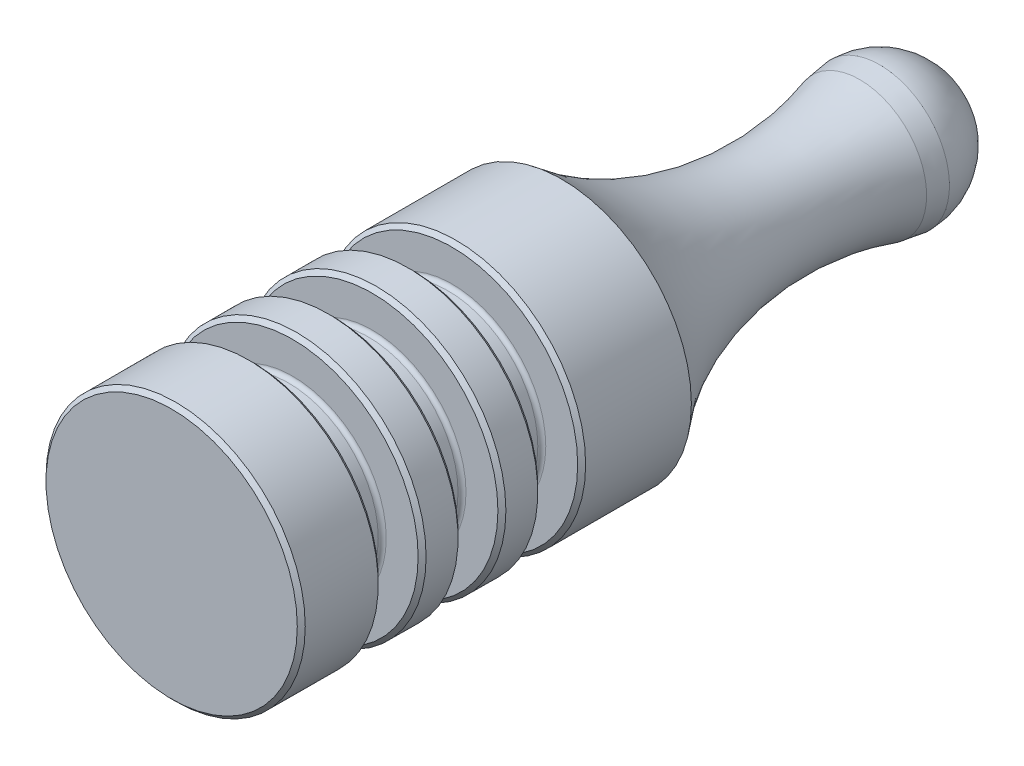
from build123d import *

# Parameters (mm, degrees)
SKIZZE1_R                       = 6.5
AUFSATZ_LINEAR_AUSTRAGEN1_DEPTH = 35.5
SKIZZE2_W                       = 2
SKIZZE2_H                       = 2
FASE1_SIZE                      = 0.2
VERRUNDUNG1_R                   = 0.2


with BuildPart() as part:
    # Skizze1 → Aufsatz-Linear austragen1 (new body)
    with BuildSketch(Plane.XY):
        Circle(SKIZZE1_R)
    extrude(amount=AUFSATZ_LINEAR_AUSTRAGEN1_DEPTH)

    # Skizze2 → Schnitt-Rotation1 (revolve, cut)
    with BuildSketch(Plane(origin=(0, 0, 0), x_dir=(0, 0, -1), z_dir=(1, 0, 0)), mode=Mode.PRIVATE) as schnitt_rotation1_sk:
        with Locations((-30.44, 5.5)):
            Rectangle(SKIZZE2_W, SKIZZE2_H)
        with Locations((-26.44, 5.5)):
            Rectangle(SKIZZE2_W, SKIZZE2_H)
        with Locations((-22.44, 5.5)):
            Rectangle(SKIZZE2_W, SKIZZE2_H)
    revolve(schnitt_rotation1_sk.sketch.rotate(Axis((0, 0, 35.5), (0, 0, -1)), 90), axis=Axis((0, 0, 35.5), (0, 0, -1)), mode=Mode.SUBTRACT)

    # Skizze5 → Schnitt-Rotation2 (revolve, cut)
    with BuildSketch(Plane(origin=(0, 0, 0), x_dir=(0, 0, -1), z_dir=(1, 0, 0)), mode=Mode.PRIVATE) as schnitt_rotation2_sk:
        with BuildLine():
            Line((-1, 3.355), (0, 3.5))
            Line((0, 3.5), (0, 6.5))
            Line((0, 6.5), (-15.94, 6.5))
            ThreePointArc((-15.94, 6.5), (-8.86931521, 3.030594044), (-1, 3.355))
        make_face()
    revolve(schnitt_rotation2_sk.sketch.rotate(Axis((0, 0, 35.5), (0, 0, -1)), 90), axis=Axis((0, 0, 35.5), (0, 0, -1)), mode=Mode.SUBTRACT)

    # Skizze6 → Rotation1 (revolve)
    with BuildSketch(Plane(origin=(0, 0, 0), x_dir=(0, 0, -1), z_dir=(1, 0, 0)), mode=Mode.PRIVATE) as rotation1_sk:
        with BuildLine():
            Line((3.5, 0), (0, 0))
            Line((0, 0), (0, 3.5))
            ThreePointArc((0, 3.5), (2.474873734, 2.474873734), (3.5, 0))
        make_face()
    revolve(rotation1_sk.sketch.rotate(Axis((0, 0, -3.5), (0, 0, 1)), 90), axis=Axis((0, 0, -3.5), (0, 0, 1)))

    # Fase1
    fase1_edges = [part.edges().sort_by_distance(p)[0] for p in [
        (-6.5, 0, 31.44),
        (-6.5, 0, 29.44),
        (-6.5, 0, 25.44),
        (-6.5, 0, 27.44),
        (-6.5, 0, 23.44),
        (-6.5, 0, 21.44),
        (-6.5, 0, 35.5),
    ]]
    chamfer(fase1_edges, length=FASE1_SIZE)

    # Verrundung1
    verrundung1_edges = [part.edges().sort_by_distance(p)[0] for p in [
        (-4.5, 0, 31.44),
        (-4.5, 0, 29.44),
        (-4.5, 0, 27.44),
        (-4.5, 0, 25.44),
        (-4.5, 0, 23.44),
        (-4.5, 0, 21.44),
    ]]
    fillet(verrundung1_edges, radius=VERRUNDUNG1_R)


solid = part.part
